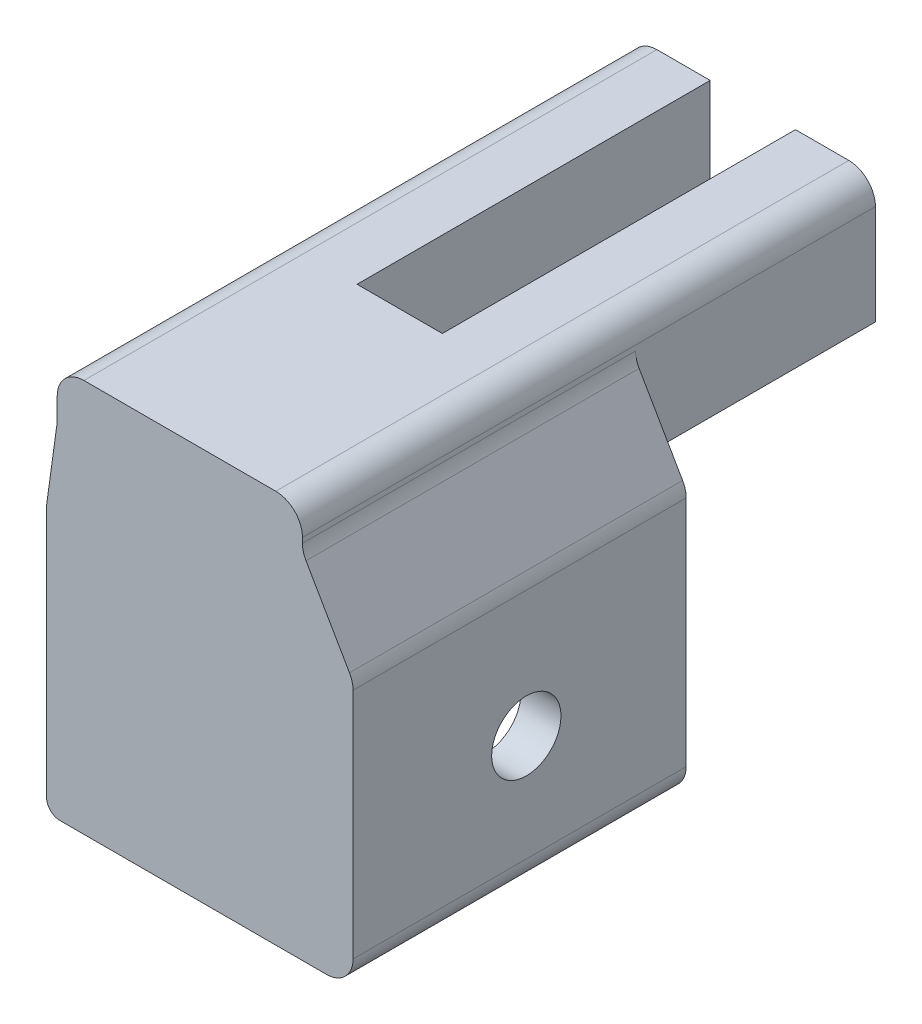
from build123d import *

# Parameters (mm, degrees)
SKETCH_1_W          = 20
SKETCH_1_H          = 20
EXTRUDE_1_DEPTH     = 3
SKETCH_2_W          = 7
SKETCH_2_H          = 6
EXTRUDE_2_DEPTH     = 40
SKETCH_3_W          = 3
SKETCH_3_H          = 20
EXTRUDE_3_DEPTH     = 25
CUT_EXTRUDE_1_REACH = 49.212
SKETCH_4_R          = 2.6
FILLET_1_R          = 1
SKETCH_5_W          = 3.2
SKETCH_5_H          = 3.9
CUT_EXTRUDE_2_DEPTH = 30
SKETCH_6_W          = 6
SKETCH_6_H          = 9.5
EXTRUDE_4_DEPTH     = 43
CHAMFER_1_SIZE      = 0.5
SKETCH_7_W          = 6.4
SKETCH_7_H          = 9.5
EXTRUDE_5_DEPTH     = 16.5
EXTRUDE_6_DEPTH     = 25
FILLET_2_R          = 2
EXTRUDE_7_DEPTH     = 43
SKETCH_10_W         = 1.9
SKETCH_10_H         = 2
CUT_EXTRUDE_3_DEPTH = 26.5
FILLET_3_R          = 0.5
FILLET_4_R          = 1


with BuildPart() as part:
    # ｽｹｯﾁ1 → ﾎﾞｽ - 押し出し1 (new body)
    with BuildSketch(Plane.XY):
        Rectangle(SKETCH_1_W, SKETCH_1_H)
    extrude(amount=EXTRUDE_1_DEPTH)

    # ｽｹｯﾁ2 → ﾎﾞｽ - 押し出し2 (add)
    with BuildSketch(Plane(origin=(0, 0, 0), x_dir=(-1, 0, 0), z_dir=(0, 0, -1))):
        with Locations((0, 7)):
            Rectangle(SKETCH_2_W, SKETCH_2_H)
    extrude(amount=EXTRUDE_2_DEPTH)

    # ｽｹｯﾁ3 → ﾎﾞｽ - 押し出し3 (add)
    with BuildSketch(Plane.XY.offset(3)):
        with Locations((11.5, 0)):
            Rectangle(SKETCH_3_W, SKETCH_3_H)
    extrude(amount=-EXTRUDE_3_DEPTH)

    # ｽｹｯﾁ4 → ｶｯﾄ - 押し出し1 (cut, up to next)
    with BuildSketch(Plane(origin=(13, 0, 0), x_dir=(0, 0, -1), z_dir=(1, 0, 0)), mode=Mode.PRIVATE) as cut_extrude_1_sk1:
        with Locations(Location((10, 0, 0), (0, 0, 90))):
            Circle(SKETCH_4_R)
    cut_extrude_1_tool1 = extrude(cut_extrude_1_sk1.sketch, amount=-CUT_EXTRUDE_1_REACH, mode=Mode.PRIVATE) & part.part
    add(cut_extrude_1_tool1.solids().sort_by_distance((13, 0, -10))[0], mode=Mode.SUBTRACT)

    # ﾌｨﾚｯﾄ1
    fillet_1_edges = [part.edges().sort_by_distance(p)[0] for p in [
        (-10, -10, 1.5),
    ]]
    fillet(fillet_1_edges, radius=FILLET_1_R)

    # ｽｹｯﾁ5 → ｶｯﾄ - 押し出し2 (cut)
    with BuildSketch(Plane(origin=(0, 0, -13.5), x_dir=(-1, 0, 0), z_dir=(0, 0, -1))):
        with Locations((0, 8.05)):
            Rectangle(SKETCH_5_W, SKETCH_5_H)
    extrude(amount=CUT_EXTRUDE_2_DEPTH, mode=Mode.SUBTRACT)

    # ｽｹｯﾁ6 → ﾎﾞｽ - 押し出し4 (add)
    with BuildSketch(Plane.XY.offset(3)):
        with Locations((6.2, 14.75)):
            Rectangle(SKETCH_6_W, SKETCH_6_H)
        with Locations((-6.2, 14.75)):
            Rectangle(SKETCH_6_W, SKETCH_6_H)
    extrude(amount=-EXTRUDE_4_DEPTH)

    # 面取り1
    chamfer_1_edges = [part.edges().sort_by_distance(p)[0] for p in [
        (-3.5, 10, -20),
        (3.5, 10, -20),
    ]]
    chamfer(chamfer_1_edges, length=CHAMFER_1_SIZE)

    # ｽｹｯﾁ7 → ﾎﾞｽ - 押し出し5 (add)
    with BuildSketch(Plane.XY.offset(3)):
        with Locations((0, 14.75)):
            Rectangle(SKETCH_7_W, SKETCH_7_H)
    extrude(amount=-EXTRUDE_5_DEPTH)

    # ｽｹｯﾁ8 → ﾎﾞｽ - 押し出し6 (add)
    with BuildSketch(Plane.XY.offset(3)):
        Polygon((13, 10), (9.2, 16.581793069), (9.2, 10), align=None)
    extrude(amount=-EXTRUDE_6_DEPTH)

    # ﾌｨﾚｯﾄ2
    fillet_2_edges = [part.edges().sort_by_distance(p)[0] for p in [
        (9.2, 16.581793069, -9.5),
        (13, 10, -9.5),
        (13, -10, -9.5),
        (9.2, 19.5, -18.5),
        (-9.2, 19.5, -18.5),
    ]]
    fillet(fillet_2_edges, radius=FILLET_2_R)

    # ｽｹｯﾁ9 → ﾎﾞｽ - 押し出し7 (add)
    with BuildSketch(Plane.XY.offset(3)):
        Polygon((-10, 10), (-9.2, 15.8), (-9.2, 10), align=None)
    extrude(amount=-EXTRUDE_7_DEPTH)

    # ｽｹｯﾁ10 → ｶｯﾄ - 押し出し3 (cut)
    with BuildSketch(Plane(origin=(0, 0, -40), x_dir=(-1, 0, 0), z_dir=(0, 0, -1))):
        with Locations((2.55, 7.1)):
            Rectangle(SKETCH_10_W, SKETCH_10_H)
    extrude(amount=-CUT_EXTRUDE_3_DEPTH, mode=Mode.SUBTRACT)

    # ﾌｨﾚｯﾄ3
    fillet_3_edges = [part.edges().sort_by_distance(p)[0] for p in [
        (-3.5, 6.1, -26.75),
        (-3.5, 8.1, -26.75),
    ]]
    fillet(fillet_3_edges, radius=FILLET_3_R)

    # ﾌｨﾚｯﾄ4
    fillet_4_edges = [part.edges().sort_by_distance(p)[0] for p in [
        (-3.5, 4, -20),
        (3.5, 4, -20),
    ]]
    fillet(fillet_4_edges, radius=FILLET_4_R)


solid = part.part
